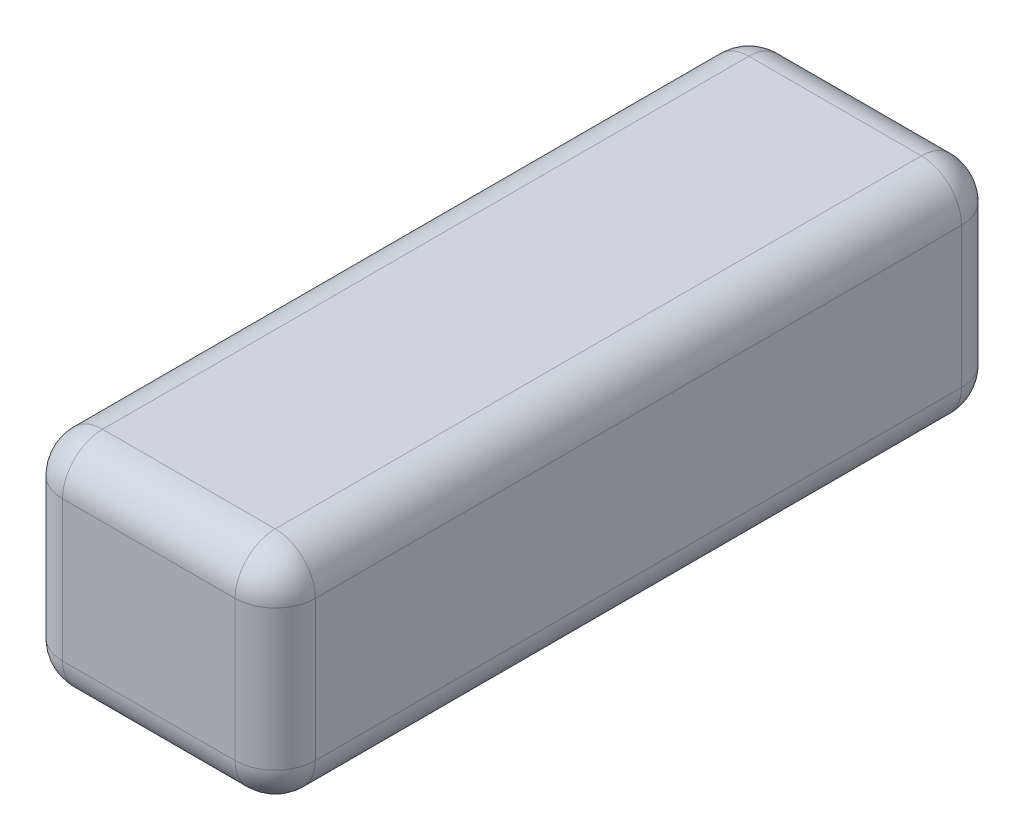
from build123d import *

# Parameters (mm, degrees)
SKETCH1_W           = 16.002
SKETCH1_H           = 45.974
BOSS_EXTRUDE1_DEPTH = 13.97
FILLET1_R           = 2.54


with BuildPart() as part:
    # Sketch1 → Boss-Extrude1 (new body)
    with BuildSketch(Plane(origin=(0, 0, 0), x_dir=(1, 0, 0), z_dir=(0, 1, 0))):
        with Locations((-8.001, 22.987)):
            Rectangle(SKETCH1_W, SKETCH1_H)
    extrude(amount=BOSS_EXTRUDE1_DEPTH)

    # Fillet1
    fillet1_edges = [part.edges().sort_by_distance(p)[0] for p in [
        (-16.002, 13.97, -22.987),
        (-8.001, 13.97, 0),
        (0, 13.97, -22.987),
        (-8.001, 0, 0),
        (-16.002, 0, -22.987),
        (-8.001, 0, -45.974),
        (0, 0, -22.987),
        (0, 6.985, 0),
        (-16.002, 6.985, 0),
        (-16.002, 6.985, -45.974),
        (0, 6.985, -45.974),
        (-8.001, 13.97, -45.974),
    ]]
    fillet(fillet1_edges, radius=FILLET1_R)


solid = part.part
